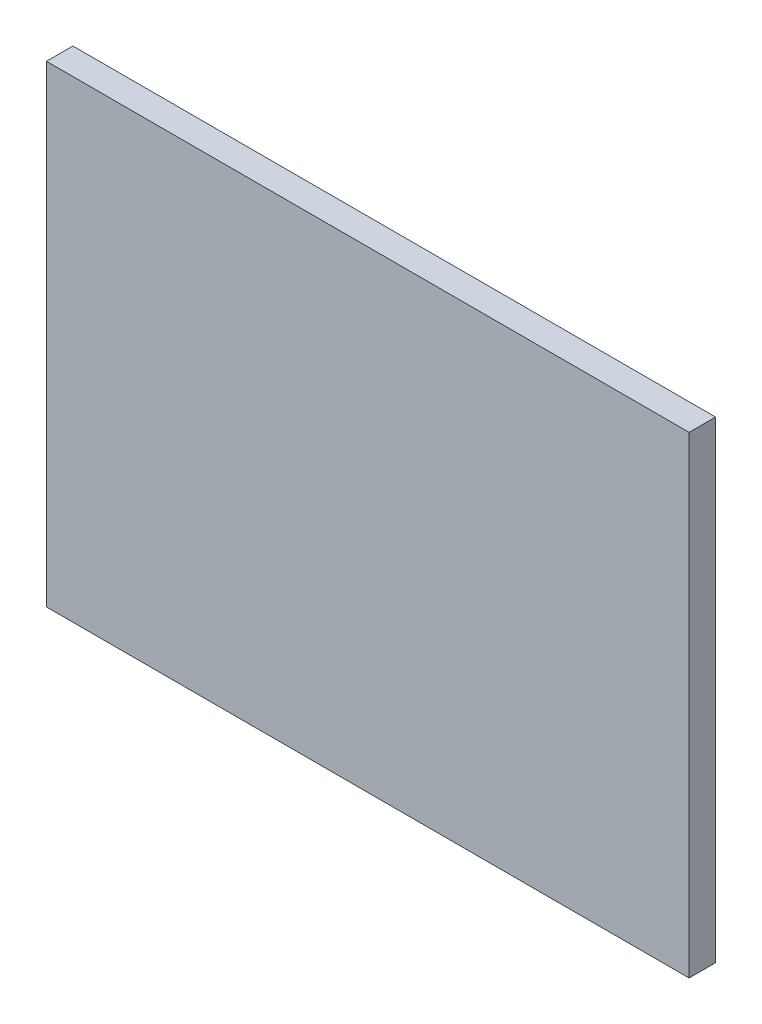
from build123d import *

# Parameters (mm, degrees)
SKETCH_1_W        = 340
SKETCH_1_H        = 250
EXTRUDE_372_DEPTH = 14


with BuildPart() as part:
    # 草图1 → Extrude 372 (new body)
    with BuildSketch(Plane.XY):
        Rectangle(SKETCH_1_W, SKETCH_1_H)
    extrude(amount=EXTRUDE_372_DEPTH)


solid = part.part
